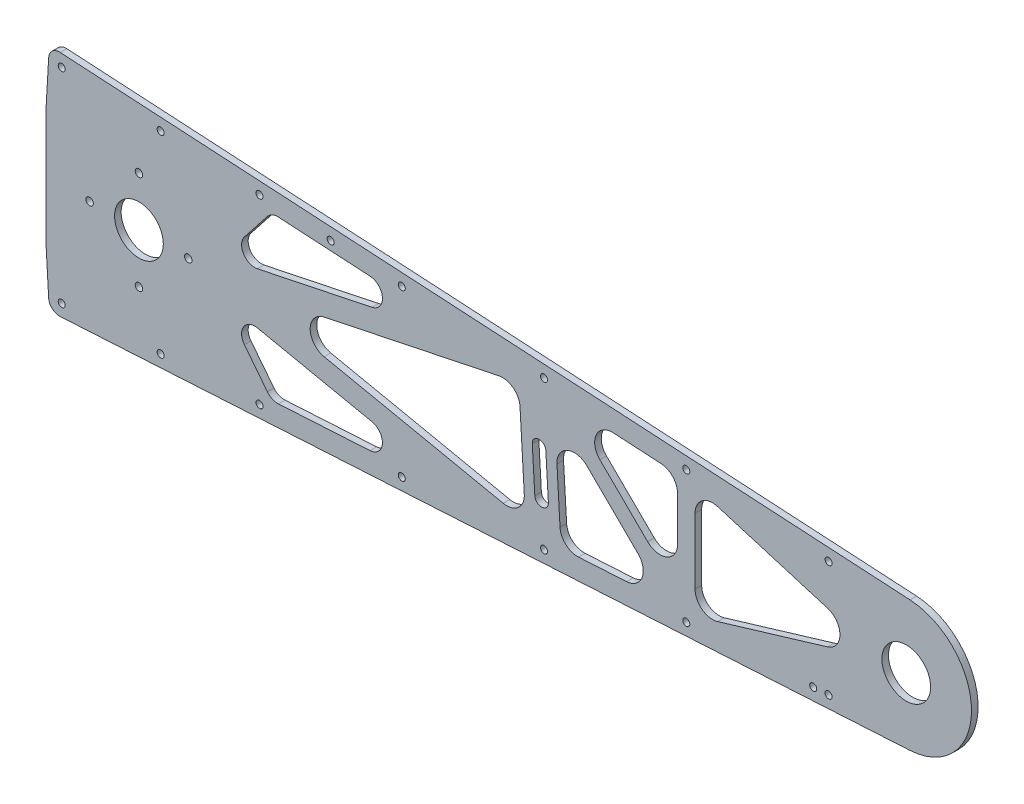
from build123d import *

# Parameters (mm, degrees)
SKETCH1_R               = 11.1125
SKETCH1_R_2             = 1.6
BOSS_EXTRUDE1_DEPTH     = 3
M3_CLEARANCE_HOLE1_D    = 3.4
CUT_EXTRUDE1_DEPTH      = 10
SKETCH10_R              = 1.6
BOSS_EXTRUDE3_DEPTH     = 3
CUT_EXTRUDE2_DEPTH      = 231.98836087
CUT_EXTRUDE2_DEPTH_BACK = 231.98836087


with BuildPart() as part:
    # Sketch1 → Boss-Extrude1 (new body)
    with BuildSketch(Plane.XY):
        with BuildLine():
            Line((-172.112162162, 49.916534261), (176.720292805, 29.735414369))
            ThreePointArc((176.720292805, 29.735414369), (204.785135135, 0), (176.720292805, -29.735414369))
            Line((176.720292805, -29.735414369), (-172.112162162, -49.916534261))
            ThreePointArc((-172.112162162, -49.916534261), (-225, 0), (-172.112162162, 49.916534261))
        make_face()
        with Locations((175, 0)):
            Circle(SKETCH1_R, mode=Mode.SUBTRACT)
        with Locations((-175, 0)):
            Circle(SKETCH1_R, mode=Mode.SUBTRACT)
        with Locations((-120, 41.392475449)):
            Circle(SKETCH1_R_2, mode=Mode.SUBTRACT)
        with Locations((-55.108505461, 37.63828626)):
            Circle(SKETCH1_R_2, mode=Mode.SUBTRACT)
        with Locations((9.782989078, 33.884097071)):
            Circle(SKETCH1_R_2, mode=Mode.SUBTRACT)
        with Locations((74.674483618, 30.129907882)):
            Circle(SKETCH1_R_2, mode=Mode.SUBTRACT)
        with Locations((139.565978157, 26.375718693)):
            Circle(SKETCH1_R_2, mode=Mode.SUBTRACT)
        with Locations(Location((139.565978157, -26.375718693, 0), (0, 0, 180))):
            Circle(SKETCH1_R_2, mode=Mode.SUBTRACT)
        with Locations(Location((74.674483618, -30.129907882, 0), (0, 0, 180))):
            Circle(SKETCH1_R_2, mode=Mode.SUBTRACT)
        with Locations(Location((9.782989078, -33.884097071, 0), (0, 0, 180))):
            Circle(SKETCH1_R_2, mode=Mode.SUBTRACT)
        with Locations(Location((-55.108505461, -37.63828626, 0), (0, 0, 180))):
            Circle(SKETCH1_R_2, mode=Mode.SUBTRACT)
        with Locations(Location((-120, -41.392475449, 0), (0, 0, 180))):
            Circle(SKETCH1_R_2, mode=Mode.SUBTRACT)
        with Locations((-87.55425273, 39.515380855)):
            Circle(SKETCH1_R_2, mode=Mode.SUBTRACT)
        with Locations((-165.112162162, -44.002364352)):
            Circle(SKETCH1_R_2, mode=Mode.SUBTRACT)
        with Locations(Location((-165.112162162, 44.002364352, 0), (0, 0, 180))):
            Circle(SKETCH1_R_2, mode=Mode.SUBTRACT)
        with Locations((132.57766336, -26.78001599)):
            Circle(SKETCH1_R_2, mode=Mode.SUBTRACT)
    extrude(amount=BOSS_EXTRUDE1_DEPTH)

    # M3 Clearance Hole1 (through all)
    with Locations(Plane.XY.offset(3)):
        with Locations((-197.5, 0), (-175, 22.5), (-152.5, 0), (-175, -22.5)):
            Hole(M3_CLEARANCE_HOLE1_D / 2)

    # Sketch7 → Cut-Extrude1 (cut)
    with BuildSketch(Plane.XY.offset(3)):
        with BuildLine():
            Line((88.975526403, 22.70262828), (139.057512253, 7.661932008))
            ThreePointArc((139.057512253, 7.661932008), (144.756469468, 0), (139.057512253, -7.661932008))
            Line((139.057512253, -7.661932008), (88.975526403, -22.70262828))
            ThreePointArc((88.975526403, -22.70262828), (81.899985858, -21.459743798), (78.674483618, -15.040696272))
            Line((78.674483618, -15.040696272), (78.674483618, 15.040696272))
            ThreePointArc((78.674483618, 15.040696272), (81.899985858, 21.459743798), (88.975526403, 22.70262828))
        make_face()
        with BuildLine():
            Line((70.674483618, -1.435965036), (70.674483618, 18.804082595))
            ThreePointArc((70.674483618, 18.804082595), (68.492405602, 24.295146589), (63.136537672, 26.790728077))
            Line((63.136537672, 26.790728077), (41.340803255, 28.05168394))
            ThreePointArc((41.340803255, 28.05168394), (33.5681452, 23.313895048), (35.260532637, 14.369808645))
            Line((35.260532637, 14.369808645), (57.056267053, -7.13119485))
            ThreePointArc((57.056267053, -7.13119485), (65.761089155, -8.816538609), (70.674483618, -1.435965036))
        make_face()
        with BuildLine():
            Line((29.274282074, 9.037636121), (52.642195402, -14.014286633))
            ThreePointArc((52.642195402, -14.014286633), (54.510022559, -22.530712895), (47.486032892, -27.696161929))
            Line((47.486032892, -27.696161929), (25.525253015, -28.966666222))
            ThreePointArc((25.525253015, -28.966666222), (19.742509337, -26.954153474), (17.076553479, -21.442074794))
            Line((17.076553479, -21.442074794), (15.669420028, 2.880352253))
            ThreePointArc((15.669420028, 2.880352253), (20.357520369, 10.630725727), (29.274282074, 9.037636121))
        make_face()
        with BuildLine():
            Line((0.769210605, -16.592065878), (-1.180512913, 17.109078816))
            ThreePointArc((-1.180512913, 17.109078816), (-4.302872031, 22.998301654), (-10.802267436, 24.478143355))
            Line((-10.802267436, 24.478143355), (-90.530788222, 7.831118593))
            ThreePointArc((-90.530788222, 7.831118593), (-96.895679181, 0), (-90.530788222, -7.831118593))
            Line((-90.530788222, -7.831118593), (-8.852543917, -24.885238525))
            ThreePointArc((-8.852543917, -24.885238525), (-1.994439382, -23.113849139), (0.769210605, -16.592065878))
        make_face()
        with BuildLine():
            Line((5.567875781, -14.698862148), (4.412740646, 5.267751556))
            ThreePointArc((4.412740646, 5.267751556), (7.328519824, 8.541622626), (10.602390894, 5.625843448))
            Line((10.602390894, 5.625843448), (11.757526029, -14.340770256))
            ThreePointArc((11.757526029, -14.340770256), (8.841746851, -17.614641327), (5.567875781, -14.698862148))
        make_face()
        with BuildLine():
            Line((-126.896651592, 21.273781799), (-116.432051872, 34.601649091))
            ThreePointArc((-116.432051872, 34.601649091), (-114.179639962, 36.365789869), (-111.366346547, 36.886301404))
            Line((-111.366346547, 36.886301404), (-69.577822511, 34.468696042))
            ThreePointArc((-69.577822511, 34.468696042), (-63.940794692, 28.922456993), (-68.698031271, 22.605372985))
            Line((-68.698031271, 22.605372985), (-120.951155027, 11.695111055))
            ThreePointArc((-120.951155027, 11.695111055), (-127.275300447, 14.404228754), (-126.896651592, 21.273781799))
        make_face()
        with BuildLine():
            Line((-111.366346547, -36.886301404), (-69.577822511, -34.468696042))
            ThreePointArc((-69.577822511, -34.468696042), (-63.940794692, -28.922456993), (-68.698031271, -22.605372985))
            Line((-68.698031271, -22.605372985), (-120.951155027, -11.695111055))
            ThreePointArc((-120.951155027, -11.695111055), (-127.275300447, -14.404228754), (-126.896651592, -21.273781799))
            Line((-126.896651592, -21.273781799), (-116.432051872, -34.601649091))
            ThreePointArc((-116.432051872, -34.601649091), (-114.179639962, -36.365789869), (-111.366346547, -36.886301404))
        make_face()
    extrude(amount=-CUT_EXTRUDE1_DEPTH, mode=Mode.SUBTRACT)

    # Sketch10 → Boss-Extrude3 (add)
    with BuildSketch(Plane.XY.offset(3)):
        with BuildLine():
            Line((-172.112162162, 49.916534261), (-210.904992847, 52.160828781))
            ThreePointArc((-210.904992847, 52.160828781), (-214.519207646, 50.903008313), (-216.185430057, 47.457959138))
            Line((-216.185430057, 47.457959138), (-217.397717482, 26.503463026))
            Line((-217.397717482, 26.503463026), (-172.112162162, 49.916534261))
        make_face()
        with Locations((-210.224324324, 46.612253255)):
            Circle(SKETCH10_R, mode=Mode.SUBTRACT)
    boss_extrude3 = extrude(amount=-BOSS_EXTRUDE3_DEPTH)

    # Mirror1: Boss-Extrude3 across plane
    add(boss_extrude3.mirror(Plane.ZX))

    # Sketch11 → Cut-Extrude2 (cut, two sides: drawn at the far end of the back side and taken through both)
    with BuildSketch(Plane(origin=(0, 0, 0), x_dir=(-1, 0, 0), z_dir=(0, 0, -1)).offset(-CUT_EXTRUDE2_DEPTH_BACK)):
        with BuildLine():
            Line((217.397717482, -26.503463026), (217.397717482, 26.503463026))
            ThreePointArc((217.397717482, 26.503463026), (225, 0), (217.397717482, -26.503463026))
        make_face()
    extrude(amount=CUT_EXTRUDE2_DEPTH + CUT_EXTRUDE2_DEPTH_BACK, mode=Mode.SUBTRACT)


solid = part.part
